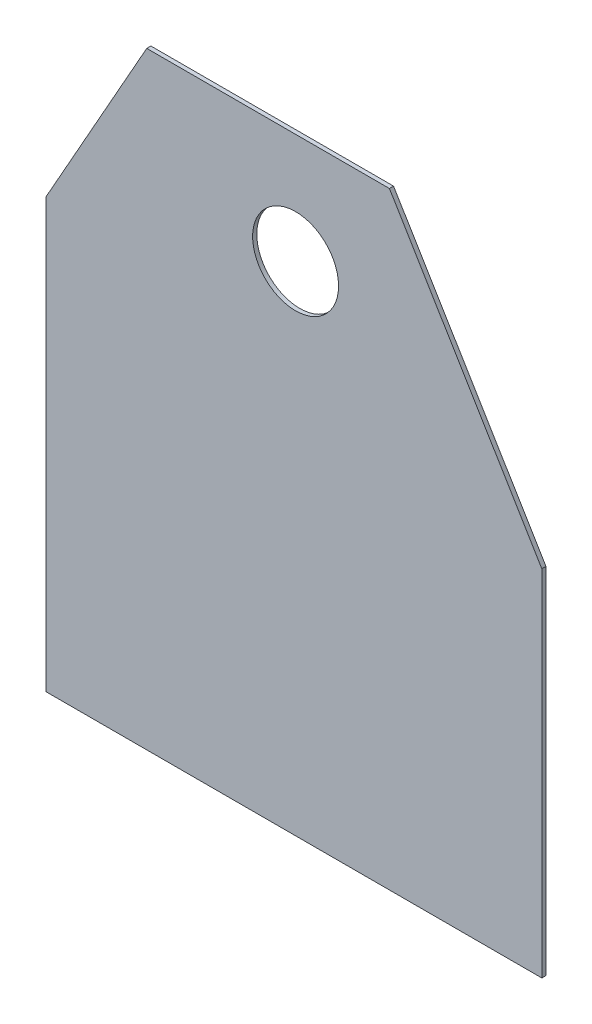
from build123d import *

# Parameters (mm, degrees)
SKETCH_1_R      = 26
EXTRUDE_1_DEPTH = 2.5


with BuildPart() as part:
    # Эскиз1 → Вытянуть1 (new body)
    with BuildSketch(Plane.XY):
        Polygon((64.976461406, 367.746916417), (211.882026761, 367.746923338), (304.134979738, 214.53056414), (304.134993214, 3.87e-06), (4, 3.87e-06), (3.999984406, 259.47553438), align=None)
        with Locations((155.072501179, 301.231243192)):
            Circle(SKETCH_1_R, mode=Mode.SUBTRACT)
    extrude(amount=EXTRUDE_1_DEPTH)


solid = part.part
